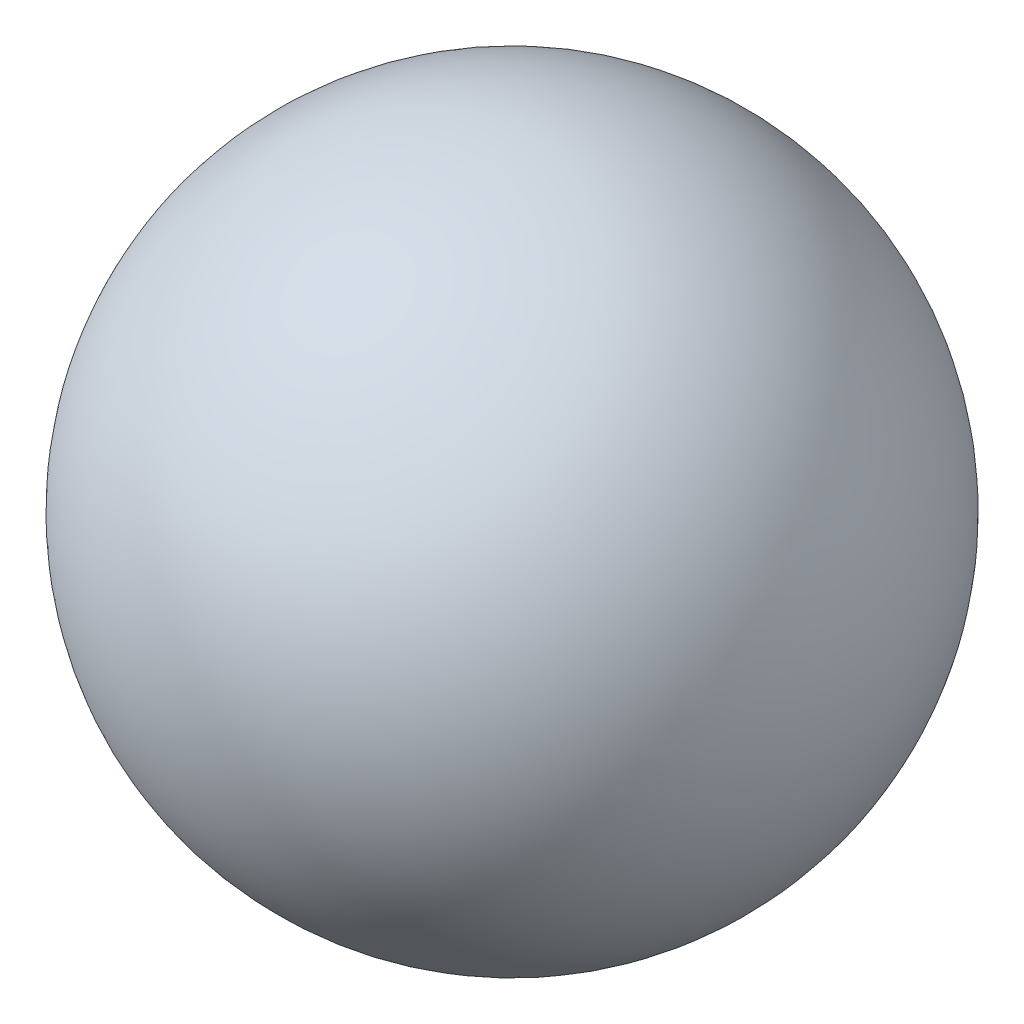
from build123d import *


with BuildPart() as part:
    # Esquisse1 → Base-Révolution (revolve)
    with BuildSketch(Plane.XY):
        with BuildLine():
            Line((-2.285714286, 10), (2.285714286, 10))
            ThreePointArc((2.285714286, 10), (0, 12.285714286), (-2.285714286, 10))
        make_face()
    revolve(axis=Axis((4.887863217, 10, 0), (-1, 0, 0)))


solid = part.part
